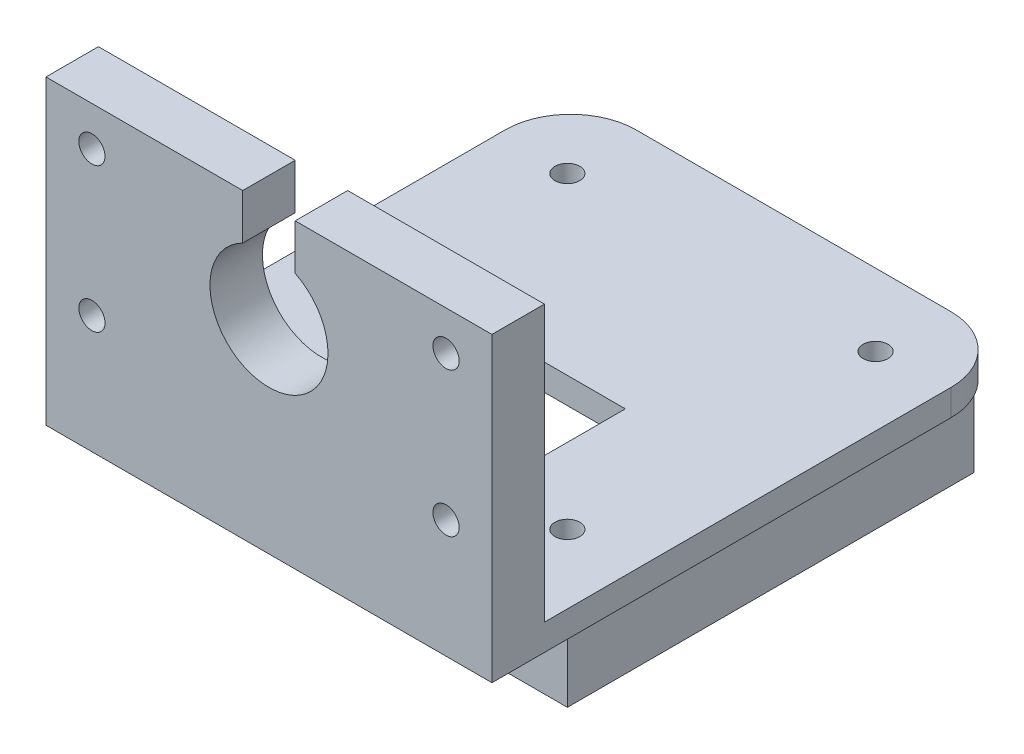
from build123d import *

# Parameters (mm, degrees)
SKETCH_1_R          = 1
EXTRUDE_1_DEPTH     = 4
SKETCH_2_W          = 34
SKETCH_2_H          = 2
EXTRUDE_2_DEPTH     = 36
SKETCH_3_R          = 0.95
SKETCH_3_W          = 12
SKETCH_3_H          = 14.169811535
CUT_EXTRUDE_1_DEPTH = 3
EXTRUDE_START       = 2
SKETCH_4_R          = 2.2
SKETCH_4_R_2        = 0.95
EXTRUDE_3_DEPTH     = 2
FILLET_1_R          = 5
EXTRUDE_5_DEPTH     = 6


with BuildPart() as part:
    # Эскиз1 → Бобышка-Вытянуть1 (new body)
    with BuildSketch(Plane.XY):
        with BuildLine():
            Line((-17, -11.5), (17, -11.5))
            Line((17, -11.5), (17, 11.5))
            Line((17, 11.5), (2, 11.5))
            Line((2, 11.5), (2, 8.031128874))
            ThreePointArc((2, 8.031128874), (0, -0.5), (-2, 8.031128874))
            Line((-2, 8.031128874), (-2, 11.5))
            Line((-2, 11.5), (-17, 11.5))
            Line((-17, 11.5), (-17, -11.5))
        make_face()
        with Locations((-13.5, 8.5)):
            Circle(SKETCH_1_R, mode=Mode.SUBTRACT)
        with Locations((13.5, 8.5)):
            Circle(SKETCH_1_R, mode=Mode.SUBTRACT)
        with Locations((-13.5, -2.5)):
            Circle(SKETCH_1_R, mode=Mode.SUBTRACT)
        with Locations((13.5, -2.5)):
            Circle(SKETCH_1_R, mode=Mode.SUBTRACT)
    extrude(amount=EXTRUDE_1_DEPTH)

    # Эскиз2 → Бобышка-Вытянуть2 (add)
    with BuildSketch(Plane(origin=(0, 0, 0), x_dir=(-1, 0, 0), z_dir=(0, 0, -1))):
        with Locations((0, -10.5)):
            Rectangle(SKETCH_2_W, SKETCH_2_H)
    extrude(amount=EXTRUDE_2_DEPTH)

    # Эскиз3 → Вырез-Вытянуть1 (cut)
    with BuildSketch(Plane.XZ.offset(11.5)):
        with Locations(Location((11.75, -7, 0), (0, 0, 270))):
            Circle(SKETCH_3_R)
        with Locations(Location((11.75, -30.5, 0), (0, 0, 270))):
            Circle(SKETCH_3_R)
        with Locations(Location((-11.75, -30.5, 0), (0, 0, 270))):
            Circle(SKETCH_3_R)
        with Locations(Location((-11.75, -7, 0), (0, 0, 270))):
            Circle(SKETCH_3_R)
        with Locations((0, -10.084905768)):
            Rectangle(SKETCH_3_W, SKETCH_3_H)
    extrude(amount=-CUT_EXTRUDE_1_DEPTH, mode=Mode.SUBTRACT)

    # Эскиз4 → Бобышка-Вытянуть3 (add)
    # profile 1 of 4: a face of its own
    with BuildSketch(Plane.XZ.offset(11.5).offset(EXTRUDE_START)):
        with Locations(Location((11.75, -7, 0), (0, 0, 90))):
            Circle(SKETCH_4_R)
        with Locations(Location((11.75, -7, 0), (0, 0, 270))):
            Circle(SKETCH_4_R_2, mode=Mode.SUBTRACT)
    # profile 2 of 4: a face of its own
    with BuildSketch(Plane.XZ.offset(11.5).offset(EXTRUDE_START)):
        with Locations(Location((11.75, -30.5, 0), (0, 0, 90))):
            Circle(SKETCH_4_R)
        with Locations(Location((11.75, -30.5, 0), (0, 0, 270))):
            Circle(SKETCH_4_R_2, mode=Mode.SUBTRACT)
    # profile 3 of 4: a face of its own
    with BuildSketch(Plane.XZ.offset(11.5).offset(EXTRUDE_START)):
        with Locations(Location((-11.75, -7, 0), (0, 0, 90))):
            Circle(SKETCH_4_R)
        with Locations(Location((-11.75, -7, 0), (0, 0, 270))):
            Circle(SKETCH_4_R_2, mode=Mode.SUBTRACT)
    # profile 4 of 4: a face of its own
    with BuildSketch(Plane.XZ.offset(11.5).offset(EXTRUDE_START)):
        with Locations(Location((-11.75, -30.5, 0), (0, 0, 90))):
            Circle(SKETCH_4_R)
        with Locations(Location((-11.75, -30.5, 0), (0, 0, 270))):
            Circle(SKETCH_4_R_2, mode=Mode.SUBTRACT)
    extrude(amount=-EXTRUDE_3_DEPTH)

    # Скругление1
    fillet_1_edges = [part.edges().sort_by_distance(p)[0] for p in [
        (17, -10.5, -36),
        (-17, -10.5, -36),
    ]]
    fillet(fillet_1_edges, radius=FILLET_1_R)

    # Эскиз5 → Бобышка-Вытянуть5 (add)
    with BuildSketch(Plane.XZ.offset(11.5)):
        Polygon((14, -32.75), (-14, -32.75), (-14, -4.75), (-6, -4.75), (-6, -3.25), (-15.5, -3.25), (-15.5, -34.25), (15.5, -34.25), (15.5, -3.25), (6, -3.25), (6, -4.75), (14, -4.75), align=None)
    extrude(amount=EXTRUDE_5_DEPTH)


solid = part.part
